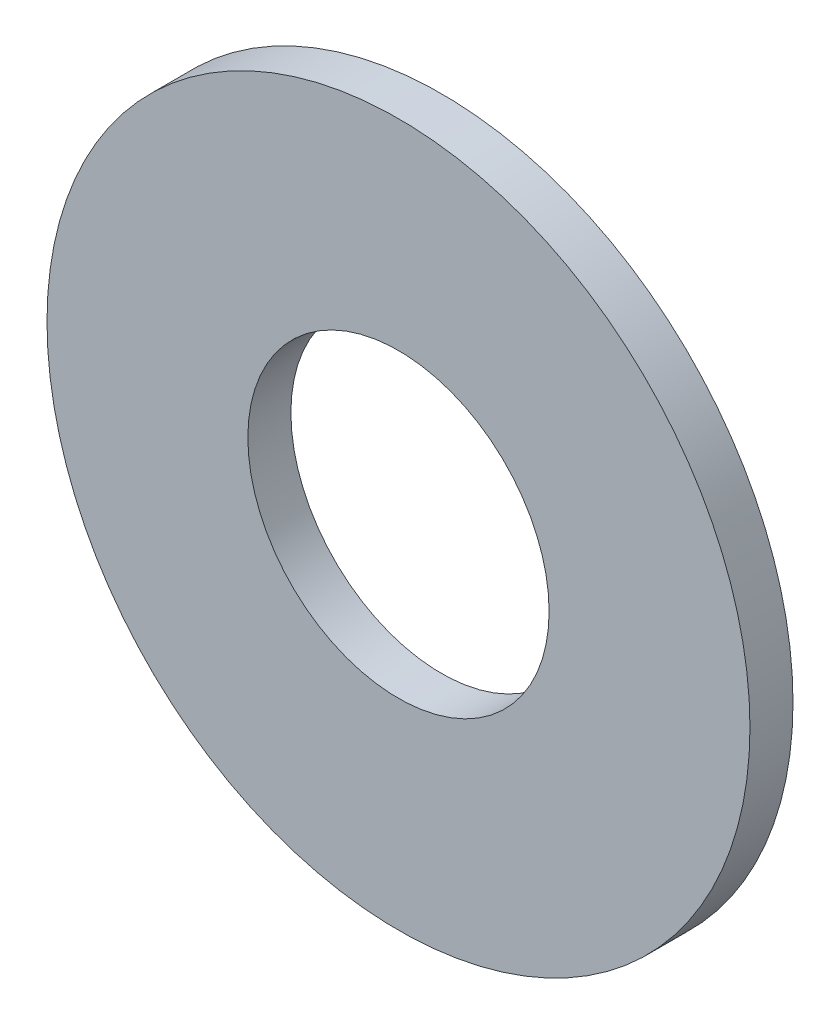
from build123d import *

# Parameters (mm, degrees)
ESQUISSE1_R        = 2.45
ESQUISSE1_R_2      = 1.05
BOSS_EXTRU_1_DEPTH = 0.3


with BuildPart() as part:
    # Esquisse1 → Boss.-Extru.1 (new body)
    with BuildSketch(Plane.XY):
        Circle(ESQUISSE1_R)
        Circle(ESQUISSE1_R_2, mode=Mode.SUBTRACT)
    extrude(amount=BOSS_EXTRU_1_DEPTH)


solid = part.part
